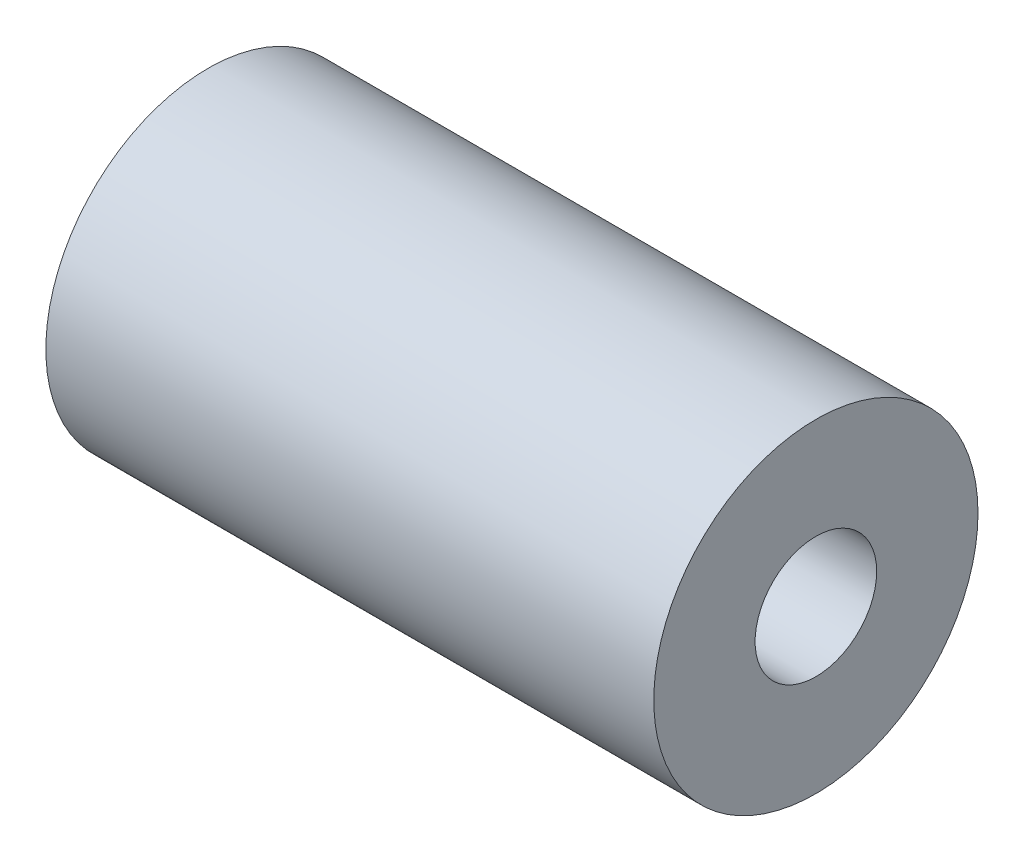
from build123d import *

# Parameters (mm, degrees)
SKETCH_1_R      = 4
SKETCH_1_R_2    = 1.5
EXTRUDE_1_DEPTH = 15


with BuildPart() as part:
    # ｽｹｯﾁ1 → ﾎﾞｽ - 押し出し1 (new body)
    with BuildSketch(Plane(origin=(0, 0, 0), x_dir=(0, 0, -1), z_dir=(1, 0, 0))):
        Circle(SKETCH_1_R)
        Circle(SKETCH_1_R_2, mode=Mode.SUBTRACT)
    extrude(amount=EXTRUDE_1_DEPTH)


solid = part.part
